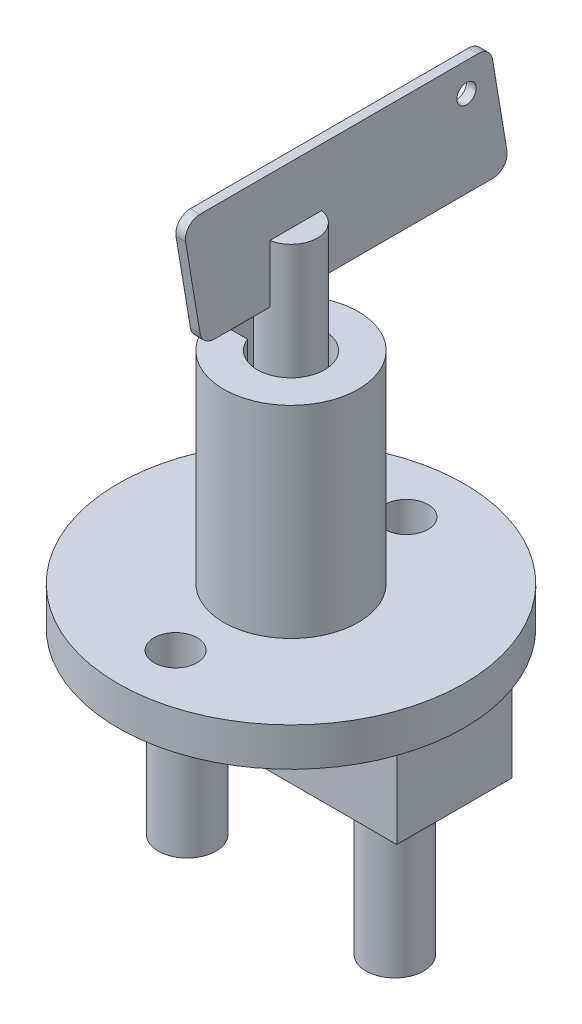
from build123d import *

# Parameters (mm, degrees)
SKETCH1_R          = 28.575
SKETCH1_R_2        = 3.571875
EXTRUDE1_DEPTH     = 6.35
SKETCH2_R          = 11.1125
EXTRUDE2_DEPTH     = 33.3375
CUT_EXTRUDE1_DEPTH = 25.4
SKETCH4_W          = 53.975
SKETCH4_H          = 19.05
EXTRUDE3_DEPTH     = 12.7
SKETCH5_R          = 4.7625
EXTRUDE4_DEPTH     = 25.4
SKETCH6_R          = 4.365625
EXTRUDE5_DEPTH     = 18.25625
EXTRUDE6_DEPTH     = 0.79375
FILLET1_R          = 2.38125
SKETCH8_R          = 1.5875
CUT_EXTRUDE2_DEPTH = 1.5875
SKETCH9_R          = 1.984375
EXTRUDE7_DEPTH     = 6.35


with BuildPart() as part:
    # Sketch1 → Extrude1 (new body)
    with BuildSketch(Plane(origin=(0, 0, 0), x_dir=(1, 0, 0), z_dir=(0, 1, 0))):
        with Locations(Location((0, 0, 0), (0, 0, 270))):
            Circle(SKETCH1_R)
        with Locations(Location((0, 19.05, 0), (0, 0, 270))):
            Circle(SKETCH1_R_2, mode=Mode.SUBTRACT)
        with Locations(Location((0, -19.05, 0), (0, 0, 270))):
            Circle(SKETCH1_R_2, mode=Mode.SUBTRACT)
    extrude(amount=EXTRUDE1_DEPTH)

    # Sketch2 → Extrude2 (add)
    with BuildSketch(Plane(origin=(0, 6.35, 0), x_dir=(-1, 0, 0), z_dir=(0, 1, 0))):
        with Locations(Location((0, 0, 0), (0, 0, 90))):
            Circle(SKETCH2_R)
    extrude(amount=EXTRUDE2_DEPTH)

    # Sketch3 → Cut-Extrude1 (cut)
    with BuildSketch(Plane(origin=(0, 39.6875, 0), x_dir=(-1, 0, 0), z_dir=(0, 1, 0))):
        with BuildLine():
            Line((7.9375, -1.984375), (5.189814055, -1.984375))
            ThreePointArc((5.189814055, -1.984375), (-5.55625, 0), (5.189814055, 1.984375))
            Line((5.189814055, 1.984375), (7.9375, 1.984375))
            Line((7.9375, 1.984375), (7.9375, -1.984375))
        make_face()
    extrude(amount=-CUT_EXTRUDE1_DEPTH, mode=Mode.SUBTRACT)

    # Sketch4 → Extrude3 (add)
    with BuildSketch(Plane.XZ):
        Rectangle(SKETCH4_W, SKETCH4_H)
    extrude(amount=EXTRUDE3_DEPTH)

    # Sketch5 → Extrude4 (add)
    with BuildSketch(Plane.XZ.offset(12.7)):
        with Locations(Location((-17.145, 0, 0), (0, 0, 90))):
            Circle(SKETCH5_R)
    extrude4 = extrude(amount=EXTRUDE4_DEPTH)

    # Mirror1: Extrude4 across plane
    add(extrude4.mirror(Plane(origin=(0, 0, 0), x_dir=(0, 0, 1), z_dir=(1, 0, 0))))


with BuildPart() as body_2:
    # Sketch6 → Extrude5 (new, symmetric)
    with BuildSketch(Plane(origin=(0, 39.6875, 0), x_dir=(-1, 0, 0), z_dir=(0, 1, 0))):
        with Locations(Location((0, 0, 0), (0, 0, 90))):
            Circle(SKETCH6_R)
    extrude(amount=EXTRUDE5_DEPTH, both=True)

    # Sketch7 → Extrude6 (add, symmetric)
    with BuildSketch(Plane(origin=(0, 0, 0), x_dir=(0, 0, -1), z_dir=(1, 0, 0))):
        Polygon((-15.478125, 48.41875), (-18.653125, 67.46875), (32.146875, 67.46875), (35.321875, 48.41875), align=None)
    extrude(amount=EXTRUDE6_DEPTH, both=True)

    # Fillet1
    fillet1_edges = [body_2.edges().sort_by_distance(p)[0] for p in [
        (0, 48.41875, 15.478125),
        (0, 48.41875, -35.321875),
        (0, 67.46875, -32.146875),
        (0, 67.46875, 18.653125),
    ]]
    fillet(fillet1_edges, radius=FILLET1_R)

    # Sketch8 → Cut-Extrude2 (cut)
    with BuildSketch(Plane(origin=(0.79375, 0, 0), x_dir=(0, 0, -1), z_dir=(1, 0, 0))):
        with Locations((28.178125, 62.70625)):
            Circle(SKETCH8_R)
    extrude(amount=-CUT_EXTRUDE2_DEPTH, mode=Mode.SUBTRACT)

    # Sketch9 → Extrude7 (add)
    with BuildSketch(Plane.XY):
        with Locations((0, 27.78125)):
            Circle(SKETCH9_R)
    extrude(amount=-EXTRUDE7_DEPTH)


solid = Compound([part.part, body_2.part])
